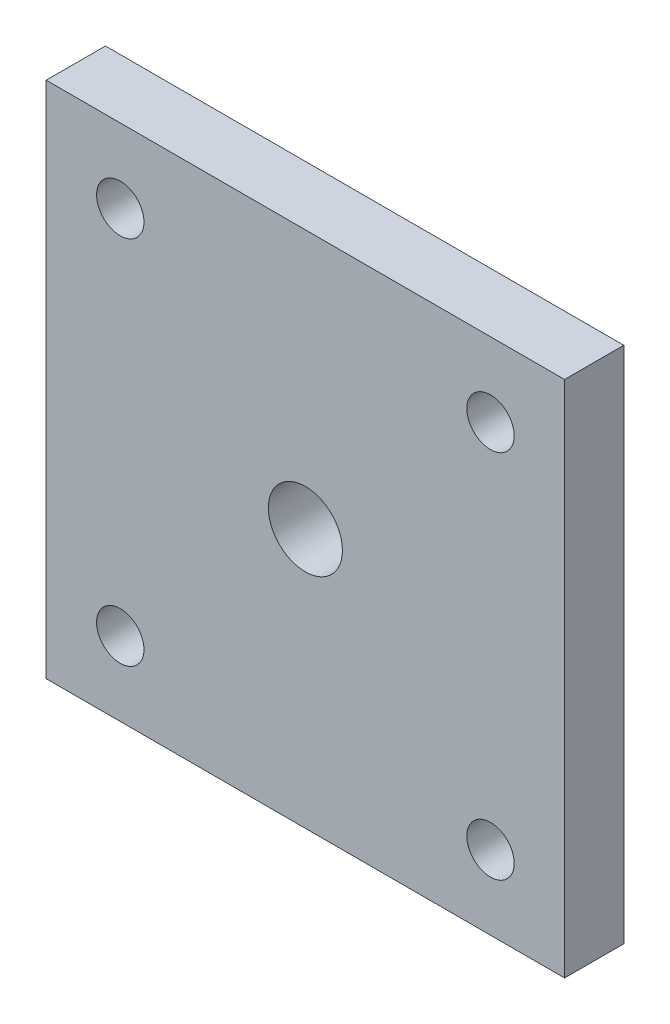
from build123d import *

# Parameters (mm, degrees)
SKETCH1_W           = 35
SKETCH1_H           = 35
BOSS_EXTRUDE1_DEPTH = 4
SKETCH3_R           = 1.6
DOWEL_CUT_DEPTH     = 26.069902273
SKETCH2_R           = 2.5
SCREW_CUT_DEPTH     = 26.069902273


with BuildPart() as part:
    # Sketch1 → Boss-Extrude1 (new body)
    with BuildSketch(Plane.XY):
        Rectangle(SKETCH1_W, SKETCH1_H)
    extrude(amount=BOSS_EXTRUDE1_DEPTH)

    # Sketch3 → Dowel cut (cut, through all)
    with BuildSketch(Plane.XY.offset(4)):
        with Locations((-12.5, 12.5)):
            Circle(SKETCH3_R)
        with Locations((12.5, 12.5)):
            Circle(SKETCH3_R)
        with Locations((12.5, -12.5)):
            Circle(SKETCH3_R)
        with Locations((-12.5, -12.5)):
            Circle(SKETCH3_R)
    extrude(amount=-DOWEL_CUT_DEPTH, mode=Mode.SUBTRACT)

    # Sketch2 → Screw cut (cut, through all)
    with BuildSketch(Plane.XY.offset(4)):
        Circle(SKETCH2_R)
    extrude(amount=-SCREW_CUT_DEPTH, mode=Mode.SUBTRACT)


solid = part.part
